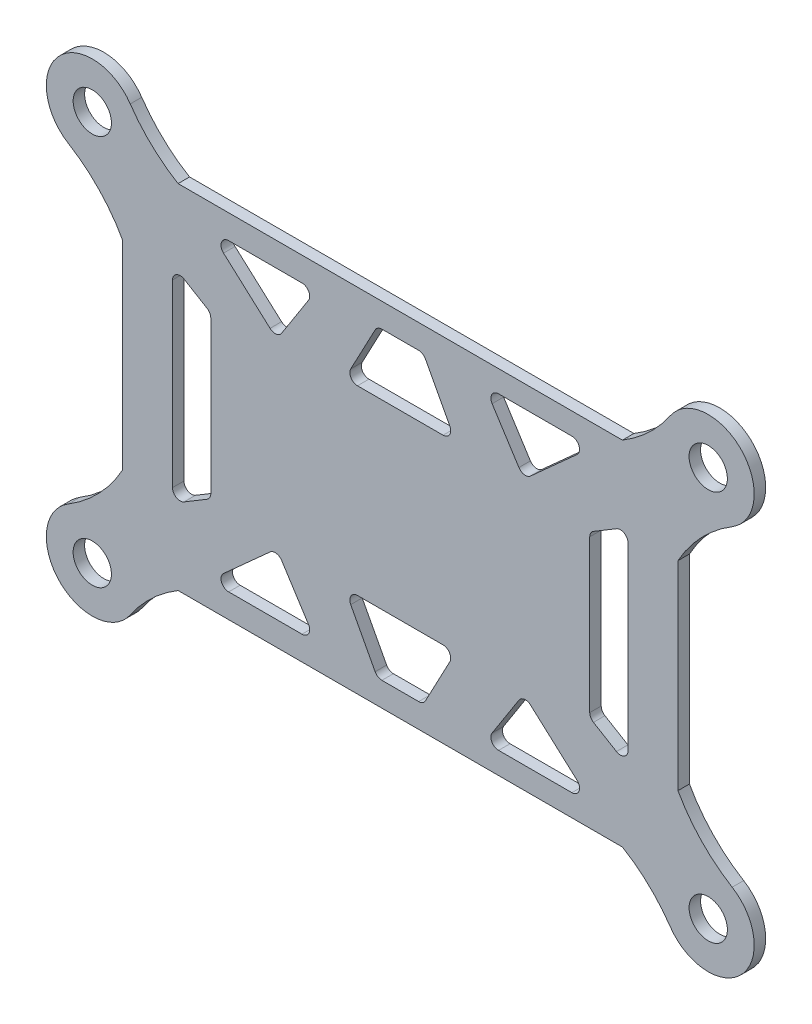
from build123d import *

# Parameters (mm, degrees)
BOSS_EXTRUDE1_DEPTH = 1.5
SKETCH2_R           = 2.5
CUT_EXTRUDE1_DEPTH  = 56.936928768


with BuildPart() as part:
    # Sketch1 → Boss-Extrude1 (new body)
    with BuildSketch(Plane.XY):
        with BuildLine():
            Line((-36.25, -13), (-36.25, 13))
            ThreePointArc((-36.25, 13), (-39.308359466, 17.14885926), (-43.325461287, 20.378331156))
            ThreePointArc((-43.325461287, 20.378331156), (-44.549693467, 29.632815837), (-35.244739735, 28.883104448))
            ThreePointArc((-35.244739735, 28.883104448), (-32.441546823, 25.602755414), (-29, 23))
            Line((-29, 23), (29, 23))
            ThreePointArc((29, 23), (32.441546823, 25.602755414), (35.244739735, 28.883104448))
            ThreePointArc((35.244739735, 28.883104448), (44.549693467, 29.632815837), (43.325461287, 20.378331156))
            ThreePointArc((43.325461287, 20.378331156), (39.308359466, 17.14885926), (36.25, 13))
            Line((36.25, 13), (36.25, -13))
            ThreePointArc((36.25, -13), (39.308359466, -17.14885926), (43.325461287, -20.378331156))
            ThreePointArc((43.325461287, -20.378331156), (44.549693467, -29.632815837), (35.244739735, -28.883104448))
            ThreePointArc((35.244739735, -28.883104448), (32.441546823, -25.602755414), (29, -23))
            Line((29, -23), (-29, -23))
            ThreePointArc((-29, -23), (-32.441546823, -25.602755414), (-35.244739735, -28.883104448))
            ThreePointArc((-35.244739735, -28.883104448), (-44.549693467, -29.632815837), (-43.325461287, -20.378331156))
            ThreePointArc((-43.325461287, -20.378331156), (-39.308359466, -17.14885926), (-36.25, -13))
        make_face()
    extrude(amount=BOSS_EXTRUDE1_DEPTH)

    # Sketch2 → Cut-Extrude1 (cut, through all)
    with BuildSketch(Plane.XY.offset(1.5)):
        with Locations((-40.2, 25.5)):
            Circle(SKETCH2_R)
        with Locations(Location((-40.2, -25.5, 0), (0, 0, 180))):
            Circle(SKETCH2_R)
        with Locations((40.2, -25.5)):
            Circle(SKETCH2_R)
        with Locations(Location((40.2, 25.5, 0), (0, 0, 180))):
            Circle(SKETCH2_R)
        with BuildLine():
            Line((-22.396410464, 19.85), (-12.826410464, 19.85))
            ThreePointArc((-12.826410464, 19.85), (-11.949193754, 19.33009462), (-11.984116418, 18.310981689))
            Line((-11.984116418, 18.310981689), (-15.482345258, 12.844493329))
            ThreePointArc((-15.482345258, 12.844493329), (-16.190773525, 12.392512169), (-16.993732126, 12.640332796))
            Line((-16.993732126, 12.640332796), (-23.065503286, 18.106821155))
            ThreePointArc((-23.065503286, 18.106821155), (-23.33, 19.208344217), (-22.396410464, 19.85))
        make_face()
        with BuildLine():
            Line((-29.733467607, 11.735), (-29.733467607, -11.735))
            ThreePointArc((-29.733467607, -11.735), (-29.226272987, -12.605139562), (-28.219181892, -12.592618915))
            Line((-28.219181892, -12.592618915), (-25.217515688, -10.792618915))
            ThreePointArc((-25.217515688, -10.792618915), (-24.861661841, -10.42780538), (-24.731801403, -9.935))
            Line((-24.731801403, -9.935), (-24.731801403, 9.935))
            ThreePointArc((-24.731801403, 9.935), (-24.861661841, 10.42780538), (-25.217515688, 10.792618915))
            Line((-25.217515688, 10.792618915), (-28.219181892, 12.592618915))
            ThreePointArc((-28.219181892, 12.592618915), (-29.226272987, 12.605139562), (-29.733467607, 11.735))
        make_face()
        with BuildLine():
            Line((-2.396410464, 19.85), (2.403589536, 19.85))
            ThreePointArc((2.403589536, 19.85), (2.918821443, 19.707050805), (3.286749377, 19.319072165))
            Line((3.286749377, 19.319072165), (6.471749377, 13.322416847))
            ThreePointArc((6.471749377, 13.322416847), (6.445640341, 12.338112776), (5.588589536, 11.853344682))
            Line((5.588589536, 11.853344682), (-5.581410464, 11.853344682))
            ThreePointArc((-5.581410464, 11.853344682), (-6.438461269, 12.338112776), (-6.464570304, 13.322416847))
            Line((-6.464570304, 13.322416847), (-3.279570304, 19.319072165))
            ThreePointArc((-3.279570304, 19.319072165), (-2.91164237, 19.707050805), (-2.396410464, 19.85))
        make_face()
        with BuildLine():
            Line((22.403589536, 20.151728768), (12.833589536, 20.151728768))
            ThreePointArc((12.833589536, 20.151728768), (11.956372827, 19.631823388), (11.99129549, 18.612710457))
            Line((11.99129549, 18.612710457), (15.48952433, 13.146222097))
            ThreePointArc((15.48952433, 13.146222097), (16.197952597, 12.694240937), (17.000911199, 12.942061564))
            Line((17.000911199, 12.942061564), (23.072682359, 18.408549924))
            ThreePointArc((23.072682359, 18.408549924), (23.337179073, 19.510072985), (22.403589536, 20.151728768))
        make_face()
        with BuildLine():
            Line((17.000911199, -12.942061564), (23.072682359, -18.408549924))
            ThreePointArc((23.072682359, -18.408549924), (23.337179073, -19.510072985), (22.403589536, -20.151728768))
            Line((22.403589536, -20.151728768), (12.833589536, -20.151728768))
            ThreePointArc((12.833589536, -20.151728768), (11.956372827, -19.631823388), (11.99129549, -18.612710457))
            Line((11.99129549, -18.612710457), (15.48952433, -13.146222097))
            ThreePointArc((15.48952433, -13.146222097), (16.197952597, -12.694240937), (17.000911199, -12.942061564))
        make_face()
        with BuildLine():
            Line((-6.464570304, -13.322416847), (-3.279570304, -19.319072165))
            ThreePointArc((-3.279570304, -19.319072165), (-2.91164237, -19.707050805), (-2.396410464, -19.85))
            Line((-2.396410464, -19.85), (2.403589536, -19.85))
            ThreePointArc((2.403589536, -19.85), (2.918821443, -19.707050805), (3.286749377, -19.319072165))
            Line((3.286749377, -19.319072165), (6.471749377, -13.322416847))
            ThreePointArc((6.471749377, -13.322416847), (6.445640341, -12.338112776), (5.588589536, -11.853344682))
            Line((5.588589536, -11.853344682), (-5.581410464, -11.853344682))
            ThreePointArc((-5.581410464, -11.853344682), (-6.438461269, -12.338112776), (-6.464570304, -13.322416847))
        make_face()
        with BuildLine():
            Line((-16.993732126, -12.640332796), (-23.065503286, -18.106821155))
            ThreePointArc((-23.065503286, -18.106821155), (-23.33, -19.208344217), (-22.396410464, -19.85))
            Line((-22.396410464, -19.85), (-12.826410464, -19.85))
            ThreePointArc((-12.826410464, -19.85), (-11.949193754, -19.33009462), (-11.984116418, -18.310981689))
            Line((-11.984116418, -18.310981689), (-15.482345258, -12.844493329))
            ThreePointArc((-15.482345258, -12.844493329), (-16.190773525, -12.392512169), (-16.993732126, -12.640332796))
        make_face()
        with BuildLine():
            Line((25.217515688, 10.792618915), (28.219181892, 12.592618915))
            ThreePointArc((28.219181892, 12.592618915), (29.226272987, 12.605139562), (29.733467607, 11.735))
            Line((29.733467607, 11.735), (29.733467607, -11.735))
            ThreePointArc((29.733467607, -11.735), (29.226272987, -12.605139562), (28.219181892, -12.592618915))
            Line((28.219181892, -12.592618915), (25.217515688, -10.792618915))
            ThreePointArc((25.217515688, -10.792618915), (24.861661841, -10.42780538), (24.731801403, -9.935))
            Line((24.731801403, -9.935), (24.731801403, 9.935))
            ThreePointArc((24.731801403, 9.935), (24.861661841, 10.42780538), (25.217515688, 10.792618915))
        make_face()
    extrude(amount=-CUT_EXTRUDE1_DEPTH, mode=Mode.SUBTRACT)


solid = part.part
